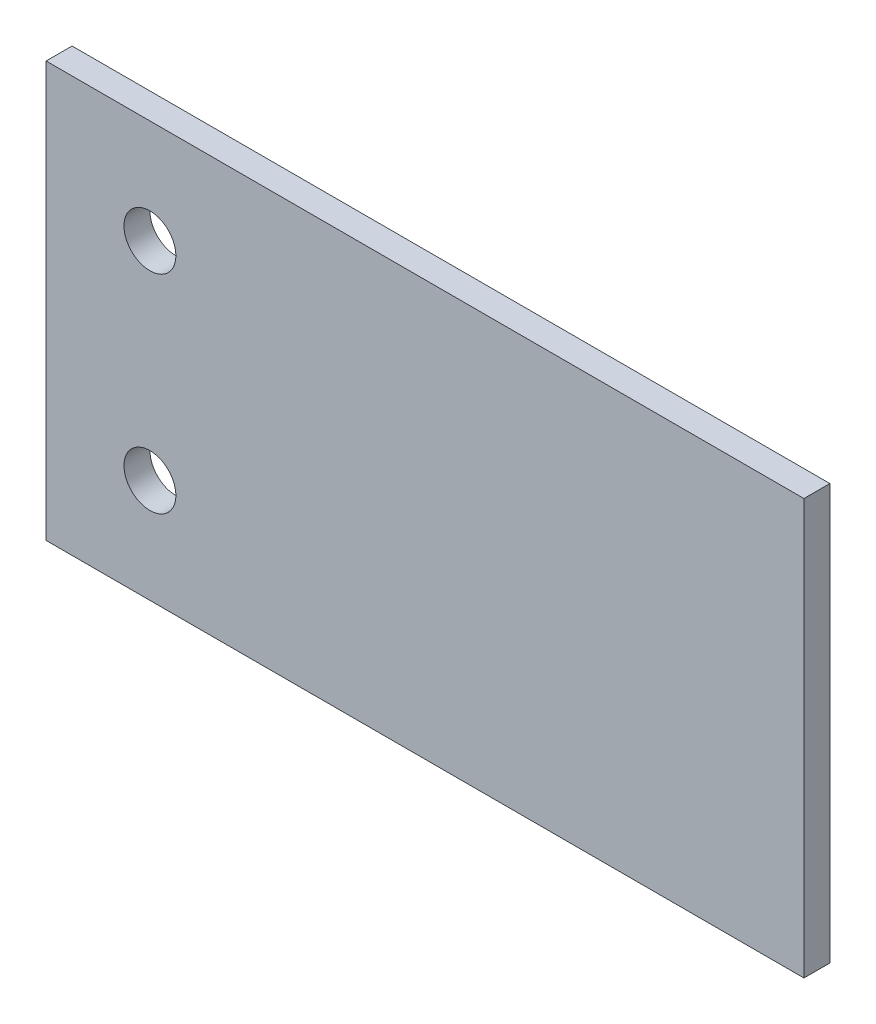
from build123d import *

# Parameters (mm, degrees)
SKETCH1_W           = 92.71
SKETCH1_H           = 50.8
SKETCH1_R           = 3.175
BOSS_EXTRUDE1_DEPTH = 3.175


with BuildPart() as part:
    # Sketch1 → Boss-Extrude1 (new body)
    with BuildSketch(Plane.XY):
        with Locations((46.355, 25.4)):
            Rectangle(SKETCH1_W, SKETCH1_H)
        with Locations((12.7, 38.1)):
            Circle(SKETCH1_R, mode=Mode.SUBTRACT)
        with Locations((12.7, 12.7)):
            Circle(SKETCH1_R, mode=Mode.SUBTRACT)
    extrude(amount=BOSS_EXTRUDE1_DEPTH)


solid = part.part
